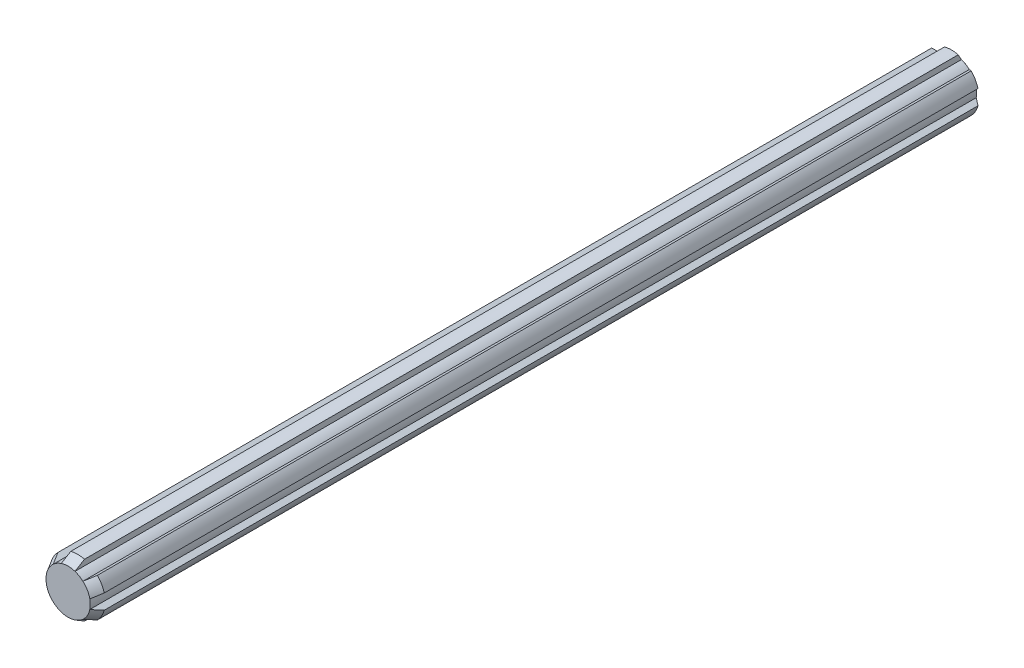
from build123d import *

# Parameters (mm, degrees)
SKETCH1_R           = 17.435
BOSS_EXTRUDE2_DEPTH = 558.8
CHAMFER2_SIZE       = 6
CHAMFER2_SIZE2      = 3.464101615
CHAMFER3_SIZE       = 3.5
CHAMFER3_SIZE2      = 2.020725942
CUT_EXTRUDE1_DEPTH  = 558.8


with BuildPart() as part:
    # Sketch1 → Boss-Extrude2 (new body)
    with BuildSketch(Plane.XY):
        Circle(SKETCH1_R)
    extrude(amount=BOSS_EXTRUDE2_DEPTH)

    # Chamfer2
    chamfer2_edges = [part.edges().sort_by_distance(p)[0] for p in [
        (-17.435, 0, 558.8),
    ]]
    chamfer2_side = [part.faces().sort_by_distance(p)[0] for p in [
        (-17.435, 0, 279.4),
    ]]
    chamfer(chamfer2_edges, length=CHAMFER2_SIZE, length2=CHAMFER2_SIZE2, reference=chamfer2_side[0])

    # Chamfer3
    chamfer3_edges = [part.edges().sort_by_distance(p)[0] for p in [
        (-17.435, 0, 0),
    ]]
    chamfer3_side = [part.faces().sort_by_distance(p)[0] for p in [
        (0, 0, 0),
    ]]
    chamfer(chamfer3_edges, length=CHAMFER3_SIZE, length2=CHAMFER3_SIZE2, reference=chamfer3_side[0])

    # Sketch3 → Cut-Extrude1 (cut)
    with BuildSketch(Plane(origin=(0, 0, 0), x_dir=(-1, 0, 0), z_dir=(0, 0, -1))):
        with BuildLine():
            Line((-4.32, 16.891323956), (-4.32, 13.258982804))
            ThreePointArc((-4.32, 13.258982804), (-6.9725, 12.076724256), (-9.322615937, 10.370721146))
            Line((-9.322615937, 10.370721146), (-12.46831565, 12.186891723))
            ThreePointArc((-12.46831565, 12.186891723), (-8.7175, 15.099152915), (-4.32, 16.891323956))
        make_face()
        with BuildLine():
            Line((12.46831565, 12.186891723), (9.322615937, 10.370721146))
            ThreePointArc((9.322615937, 10.370721146), (6.9725, 12.076724256), (4.32, 13.258982804))
            Line((4.32, 13.258982804), (4.32, 16.891323956))
            ThreePointArc((4.32, 16.891323956), (8.7175, 15.099152915), (12.46831565, 12.186891723))
        make_face()
        with BuildLine():
            Line((16.78831565, 4.704432234), (13.642615937, 2.888261658))
            ThreePointArc((13.642615937, 2.888261658), (13.945, 0), (13.642615937, -2.888261658))
            Line((13.642615937, -2.888261658), (16.78831565, -4.704432234))
            ThreePointArc((16.78831565, -4.704432234), (17.435, 0), (16.78831565, 4.704432234))
        make_face()
        with BuildLine():
            Line((12.46831565, -12.186891723), (9.322615937, -10.370721146))
            ThreePointArc((9.322615937, -10.370721146), (6.9725, -12.076724256), (4.32, -13.258982804))
            Line((4.32, -13.258982804), (4.32, -16.891323956))
            ThreePointArc((4.32, -16.891323956), (8.7175, -15.099152915), (12.46831565, -12.186891723))
        make_face()
        with BuildLine():
            Line((-4.32, -16.891323956), (-4.32, -13.258982804))
            ThreePointArc((-4.32, -13.258982804), (-6.9725, -12.076724256), (-9.322615937, -10.370721146))
            Line((-9.322615937, -10.370721146), (-12.46831565, -12.186891723))
            ThreePointArc((-12.46831565, -12.186891723), (-8.7175, -15.099152915), (-4.32, -16.891323956))
        make_face()
        with BuildLine():
            Line((-16.78831565, -4.704432234), (-13.642615937, -2.888261658))
            ThreePointArc((-13.642615937, -2.888261658), (-13.945, 0), (-13.642615937, 2.888261658))
            Line((-13.642615937, 2.888261658), (-16.78831565, 4.704432234))
            ThreePointArc((-16.78831565, 4.704432234), (-17.435, 0), (-16.78831565, -4.704432234))
        make_face()
    extrude(amount=-CUT_EXTRUDE1_DEPTH, mode=Mode.SUBTRACT)


solid = part.part
